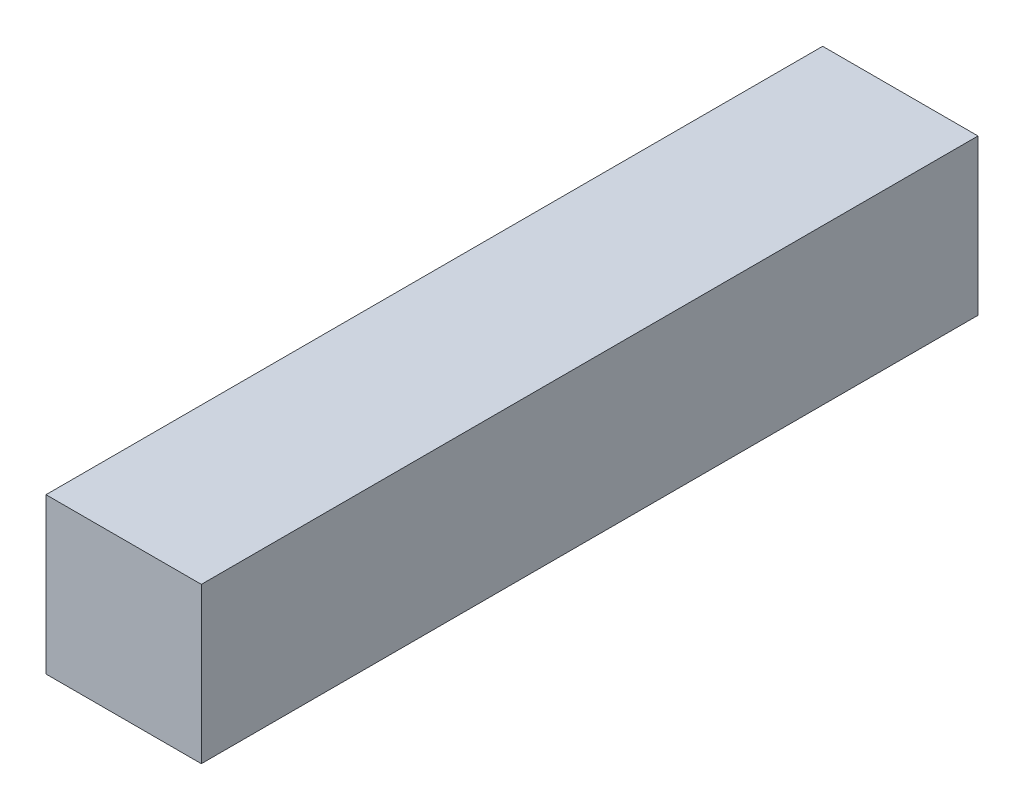
from build123d import *

# Parameters (mm, degrees)
SKETCH_1_W      = 40000
SKETCH_1_H      = 40000
EXTRUDE_1_DEPTH = 200000


with BuildPart() as part:
    # 草图1 → 凸台-拉伸1 (new body)
    with BuildSketch(Plane.XY):
        with Locations((20000, 20000)):
            Rectangle(SKETCH_1_W, SKETCH_1_H)
    extrude(amount=-EXTRUDE_1_DEPTH)


solid = part.part
